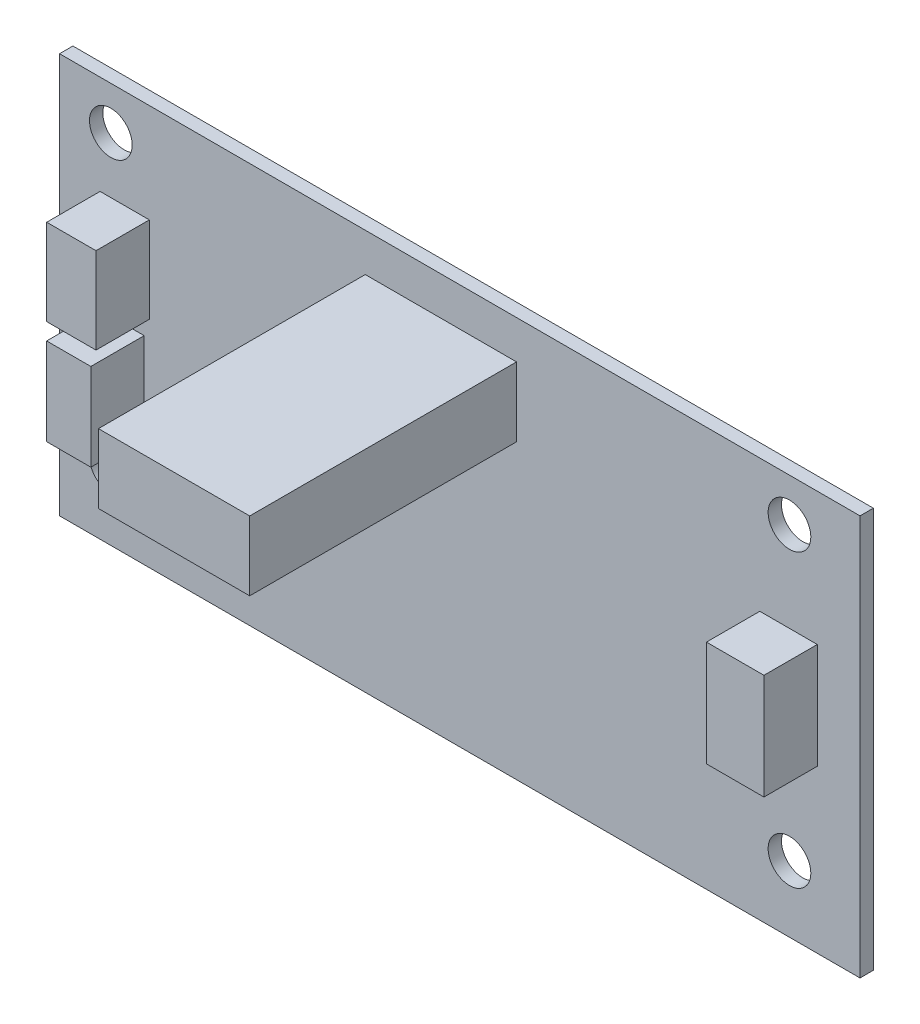
from build123d import *

# Parameters (mm, degrees)
SKETCH_1_W          = 60
SKETCH_1_H          = 30
EXTRUDE_1_DEPTH     = 1
CUT_EXTRUDE_1_REACH = 44.438
SKETCH_2_R          = 1.6
SKETCH_2_3_R        = 1.6
CUT_EXTRUDE_2_DEPTH = 1
SKETCH_3_W          = 11.33901572
SKETCH_3_H          = 5.18636438
EXTRUDE_2_DEPTH     = 20
SKETCH_5_W          = 3.694083694
SKETCH_5_H          = 6.454031282
SKETCH_5_W_2        = 3.311937105
SKETCH_5_H_2        = 6.538952746
SKETCH_5_W_3        = 4.308869274
SKETCH_5_H_3        = 7.904993255
EXTRUDE_3_DEPTH     = 5


with BuildPart() as part:
    # 草图1 → 凸台-拉伸1 (new body)
    with BuildSketch(Plane.XY):
        with Locations((0, 15)):
            Rectangle(SKETCH_1_W, SKETCH_1_H)
    extrude(amount=EXTRUDE_1_DEPTH)

    # 草图2 → 切除-拉伸1 (cut, up to next)
    with BuildSketch(Plane.XY.offset(1), mode=Mode.PRIVATE) as cut_extrude_1_sk1:
        with Locations((-26.155810983, 4.958036855)):
            Circle(SKETCH_2_R)
    cut_extrude_1_tool1 = extrude(cut_extrude_1_sk1.sketch, amount=-CUT_EXTRUDE_1_REACH, mode=Mode.PRIVATE) & part.part
    add(cut_extrude_1_tool1.solids().sort_by_distance((-26.155811, 4.958037, 1))[0], mode=Mode.SUBTRACT)

    # 草图2<3> → 切除-拉伸2 (cut)
    with BuildSketch(Plane.XY.offset(1)):
        with Locations((-26.155810983, 26.782853162)):
            Circle(SKETCH_2_3_R)
        with Locations((-26.155810983, 4.958036855)):
            Circle(SKETCH_2_3_R)
        with Locations((24.712146091, 26.782853162)):
            Circle(SKETCH_2_3_R)
        with Locations((24.712146091, 4.958036855)):
            Circle(SKETCH_2_3_R)
    extrude(amount=-CUT_EXTRUDE_2_DEPTH, mode=Mode.SUBTRACT)

    # 草图3 → 凸台-拉伸2 (add)
    with BuildSketch(Plane.XY.offset(1)):
        with Locations((-1.41614663, 24.527155888)):
            Rectangle(SKETCH_3_W, SKETCH_3_H)
    extrude(amount=EXTRUDE_2_DEPTH)

    # 草图5 → 凸台-拉伸3 (add)
    with BuildSketch(Plane.XY):
        with Locations((-25.115523047, 19.352225042)):
            Rectangle(SKETCH_5_W, SKETCH_5_H)
        with Locations((-25.311844501, 11.600994733)):
            Rectangle(SKETCH_5_W_2, SKETCH_5_H_2)
        with Locations((24.643382961, 16.097003055)):
            Rectangle(SKETCH_5_W_3, SKETCH_5_H_3)
    extrude(amount=EXTRUDE_3_DEPTH)


solid = part.part
